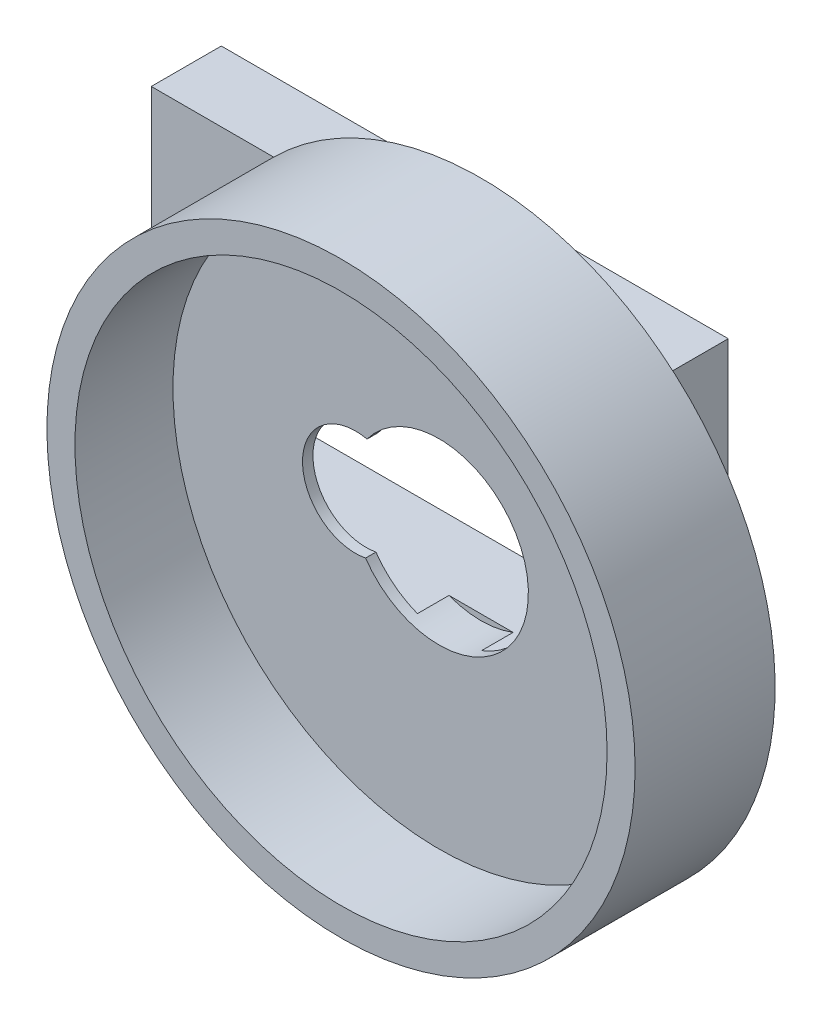
from build123d import *

# Parameters (mm, degrees)
ESQUISSE1_W             = 36.200001836
ESQUISSE1_H             = 29.499999305
BOSS_EXTRU_1_DEPTH      = 5
ESQUISSE2_W             = 33.052998595
ESQUISSE2_H             = 12.371999211
ENL_V_MAT_EXTRU_1_DEPTH = 5
BOSS_EXTRU_2_START      = 5
ESQUISSE3_W             = 4.558359629
ESQUISSE3_H             = 12.371999211
ESQUISSE3_W_2           = 4.999999888
ESQUISSE3_H_2           = 12.380001135
BOSS_EXTRU_2_DEPTH      = 3.5
BOSS_EXTRU_5_DEPTH      = 2
BOSS_EXTRU_5_DEPTH_BACK = 1
BOSS_EXTRU_5_START      = 6
ESQUISSE4_R             = 12.398139185
ENL_V_MAT_EXTRU_3_REACH = 49.691
ESQUISSE6_W             = 2.256513492
ESQUISSE6_H             = 12.371999211
SKETCH4_R               = 21
SKETCH4_R_2             = 19
BOSS_EXTRUDE2_DEPTH     = 10
SKETCH5_R               = 20
SKETCH5_R_2             = 12.35
BOSS_EXTRUDE7_DEPTH     = 0.75


with BuildPart() as part:
    # Esquisse1 → Boss.-Extru.1 (new body)
    with BuildSketch(Plane.XY):
        with Locations((5.10000065, -15.249999676)):
            Rectangle(ESQUISSE1_W, ESQUISSE1_H)
    extrude(amount=BOSS_EXTRU_1_DEPTH)

    # Esquisse2 → Enlèv. mat.-Extru.1 (cut)
    with BuildSketch(Plane.XY):
        with Locations((4.523499403, -15.158999246)):
            Rectangle(ESQUISSE2_W, ESQUISSE2_H)
    extrude(amount=ENL_V_MAT_EXTRU_1_DEPTH, mode=Mode.SUBTRACT)

    # Esquisse3 → Boss.-Extru.2 (add)
    with BuildSketch(Plane.XY.offset(BOSS_EXTRU_2_START)):
        with Locations((18.770818887, -15.158999246)):
            Rectangle(ESQUISSE3_W, ESQUISSE3_H)
        with Locations((-9.50299995, -15.163000208)):
            Rectangle(ESQUISSE3_W_2, ESQUISSE3_H_2)
    extrude(amount=-BOSS_EXTRU_2_DEPTH)

    # Esquisse4 → Boss.-Extru.5 (add, two sides: drawn at the far end of the back side and taken through both)
    with BuildSketch(Plane.XY.offset(BOSS_EXTRU_5_START - BOSS_EXTRU_5_DEPTH_BACK)):
        with Locations((10.5484362, -15.38812394)):
            Circle(ESQUISSE4_R)
        with BuildLine():
            ThreePointArc((5.299216058, -19.01722353), (16.929328279, -15.482422447), (5.408748548, -11.605494329))
            ThreePointArc((5.408748548, -11.605494329), (0.800592824, -15.244067738), (5.299216058, -19.01722353))
        make_face(mode=Mode.SUBTRACT)
    extrude(amount=BOSS_EXTRU_5_DEPTH + BOSS_EXTRU_5_DEPTH_BACK)

    # Enlèv. mat.-Extru.3: up to this face of the body (flat: up to its plane)
    enl_v_mat_extru_3_end = Plane(part.part.faces().sort_by_distance((16.491639072, -15.158999246, 3.25))[0])
    # Esquisse6 → Enlèv. mat.-Extru.3 (cut, up to the picked face)
    with BuildSketch(Plane.ZY.offset(13.000000268), mode=Mode.PRIVATE) as enl_v_mat_extru_3_sk1:
        with Locations((6.128256634, -15.158999246)):
            Rectangle(ESQUISSE6_W, ESQUISSE6_H)
    enl_v_mat_extru_3_tool1 = split(extrude(enl_v_mat_extru_3_sk1.sketch, amount=-ENL_V_MAT_EXTRU_3_REACH, mode=Mode.PRIVATE), bisect_by=enl_v_mat_extru_3_end, keep=Keep.BOTH, mode=Mode.PRIVATE)
    add(enl_v_mat_extru_3_tool1.solids().sort_by(Axis((-13, -15.158999, 6.128257), (1, 0, 0)))[0], mode=Mode.SUBTRACT)

    # Sketch4 → Boss-Extrude2 (add)
    with BuildSketch(Plane.XY.offset(5)):
        with Locations(Location((10.5484362, -15.38812394, 0), (0, 0, 224.09128758))):
            Circle(SKETCH4_R)
        with Locations(Location((10.5484362, -15.38812394, 0), (0, 0, 230.268304167))):
            Circle(SKETCH4_R_2, mode=Mode.SUBTRACT)
    extrude(amount=BOSS_EXTRUDE2_DEPTH)

    # Sketch5 → Boss-Extrude7 (add)
    with BuildSketch(Plane.XY.offset(8)):
        with Locations((10.5484362, -15.38812394)):
            Circle(SKETCH5_R)
        with Locations((10.5484362, -15.38812394)):
            Circle(SKETCH5_R_2, mode=Mode.SUBTRACT)
    extrude(amount=-BOSS_EXTRUDE7_DEPTH)


solid = part.part
